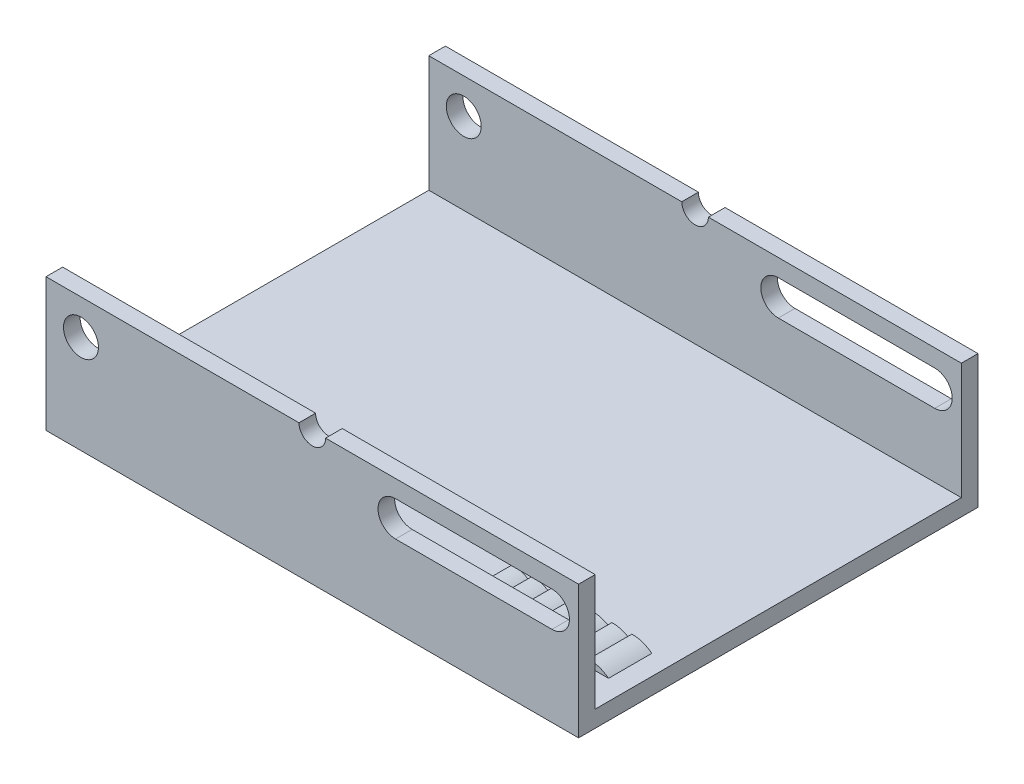
from build123d import *

# Parameters (mm, degrees)
AUFSATZ_LINEAR_AUSTRAGEN3_DEPTH      = 80
SCHNITT_LINEAR_AUSTRAGEN1_DEPTH      = 150.666295471
SCHNITT_LINEAR_AUSTRAGEN1_DEPTH_BACK = 150.666295471
SKIZZE10_R                           = 5.25
SCHNITT_LINEAR_AUSTRAGEN2_DEPTH      = 108.703296143
SCHNITT_LINEAR_AUSTRAGEN2_DEPTH_BACK = 108.703296143
AUFSATZ_LINEAR_AUSTRAGEN4_DEPTH      = 45
LINEARES_MUSTER1_COUNT               = 7
LINEARES_MUSTER1_PITCH               = 6
SKIZZE19_W                           = 160
SKIZZE19_H                           = 35
SCHNITT_LINEAR_AUSTRAGEN3_DEPTH      = 32


with BuildPart() as part:
    # Skizze9 → Aufsatz-Linear austragen3 (new, symmetric)
    with BuildSketch(Plane(origin=(0, 0, 0), x_dir=(0, 0, -1), z_dir=(1, 0, 0))):
        Polygon((-60, 40), (-60, 0), (60, 0), (60, 40), (55, 40), (55, 5), (-55, 5), (-55, 40), align=None)
    extrude(amount=AUFSATZ_LINEAR_AUSTRAGEN3_DEPTH, both=True)

    # Skizze10 → Schnitt-Linear austragen1 (cut, two sides: drawn at the far end of the back side and taken through both)
    with BuildSketch(Plane.XY.offset(60).offset(-SCHNITT_LINEAR_AUSTRAGEN1_DEPTH_BACK)):
        with Locations(Location((-69.5, 29.5, 0), (0, 0, 270))):
            Circle(SKIZZE10_R)
        with BuildLine():
            Line((25, 34.75), (72, 34.75))
            ThreePointArc((72, 34.75), (77.25, 29.5), (72, 24.25))
            Line((72, 24.25), (25, 24.25))
            ThreePointArc((25, 24.25), (19.75, 29.5), (25, 34.75))
        make_face()
    extrude(amount=SCHNITT_LINEAR_AUSTRAGEN1_DEPTH + SCHNITT_LINEAR_AUSTRAGEN1_DEPTH_BACK, mode=Mode.SUBTRACT)

    # Skizze12 → Schnitt-Linear austragen2 (cut, two sides: drawn at the far end of the back side and taken through both)
    with BuildSketch(Plane.XY.offset(-SCHNITT_LINEAR_AUSTRAGEN2_DEPTH_BACK)):
        with BuildLine():
            Line((-4, 40), (4, 40))
            ThreePointArc((4, 40), (0, 36), (-4, 40))
        make_face()
    extrude(amount=SCHNITT_LINEAR_AUSTRAGEN2_DEPTH + SCHNITT_LINEAR_AUSTRAGEN2_DEPTH_BACK, mode=Mode.SUBTRACT)

    # Skizze18 → Aufsatz-Linear austragen4 (add)
    with BuildSketch(Plane(origin=(0, 0, 0), x_dir=(-1, 0, 0), z_dir=(0, 0, -1))):
        with BuildLine():
            Line((-32, 5), (-38, 5))
            add(Edge.make_bspline(
                [(-38, 5), (-35.16767955, 7.124664511), (-32, 7)],
                knots=[0, 0, 0, 0.477297659, 0.477297659, 0.477297659], degree=2))
            Line((-32, 7), (-32, 5))
        make_face()
    aufsatz_linear_austragen4 = extrude(amount=-AUFSATZ_LINEAR_AUSTRAGEN4_DEPTH)

    # Lineares Muster1: Aufsatz-Linear austragen4 ×7
    with Locations(*[(i * LINEARES_MUSTER1_PITCH, 0, 0) for i in range(1, LINEARES_MUSTER1_COUNT)]):
        add(aufsatz_linear_austragen4)

    # Skizze19 → Schnitt-Linear austragen3 (cut)
    with BuildSketch(Plane.XY):
        with Locations((0, 22.5)):
            Rectangle(SKIZZE19_W, SKIZZE19_H)
    extrude(amount=SCHNITT_LINEAR_AUSTRAGEN3_DEPTH, mode=Mode.SUBTRACT)


solid = part.part
